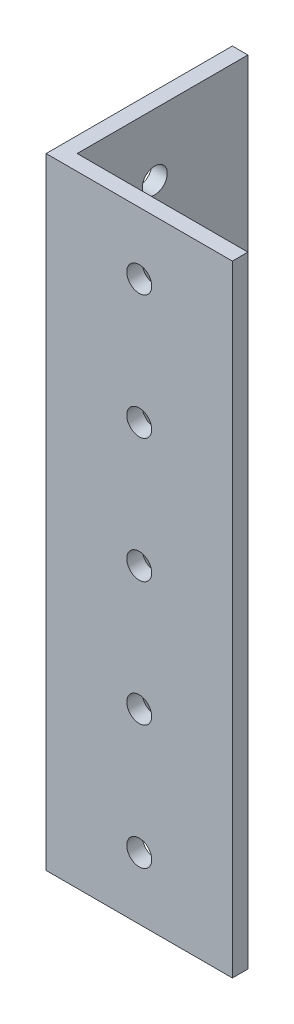
from build123d import *

# Parameters (mm, degrees)
BOSS_EXTRUDE1_DEPTH = 127
SKETCH3_R           = 2.5527
CUT_EXTRUDE1_DEPTH  = 137.977657098
LPATTERN1_COUNT     = 5
LPATTERN1_PITCH     = 25.4
SKETCH4_R           = 2.5527
CUT_EXTRUDE2_DEPTH  = 136.863765286
LPATTERN2_COUNT     = 5
LPATTERN2_PITCH     = 25.4


with BuildPart() as part:
    # Sketch2 → Boss-Extrude1 (new body)
    with BuildSketch(Plane(origin=(0, 0, 0), x_dir=(1, 0, 0), z_dir=(0, 1, 0))):
        Polygon((-33.319770297, 37.604825743), (-33.319770297, -0.495174257), (4.780229703, -0.495174257), (4.780229703, 2.679825743), (-30.144770297, 2.679825743), (-30.144770297, 37.604825743), align=None)
    extrude(amount=BOSS_EXTRUDE1_DEPTH)

    # Sketch3 → Cut-Extrude1 (cut, through all)
    with BuildSketch(Plane(origin=(-30.144770297, 0, 0), x_dir=(0, 0, -1), z_dir=(1, 0, 0))):
        with Locations((18.554825743, 12.7)):
            Circle(SKETCH3_R)
    cut_extrude1 = extrude(amount=-CUT_EXTRUDE1_DEPTH, mode=Mode.SUBTRACT)

    # LPattern1: Cut-Extrude1 ×5
    with Locations(*[(0, i * LPATTERN1_PITCH, 0) for i in range(1, LPATTERN1_COUNT)]):
        add(cut_extrude1, mode=Mode.SUBTRACT)

    # Sketch4 → Cut-Extrude2 (cut, through all)
    with BuildSketch(Plane(origin=(0, 0, -2.679825743), x_dir=(-1, 0, 0), z_dir=(0, 0, -1))):
        with Locations((14.269770297, 12.7)):
            Circle(SKETCH4_R)
    cut_extrude2 = extrude(amount=-CUT_EXTRUDE2_DEPTH, mode=Mode.SUBTRACT)

    # LPattern2: Cut-Extrude2 ×5
    with Locations(*[(0, i * LPATTERN2_PITCH, 0) for i in range(1, LPATTERN2_COUNT)]):
        add(cut_extrude2, mode=Mode.SUBTRACT)


solid = part.part
